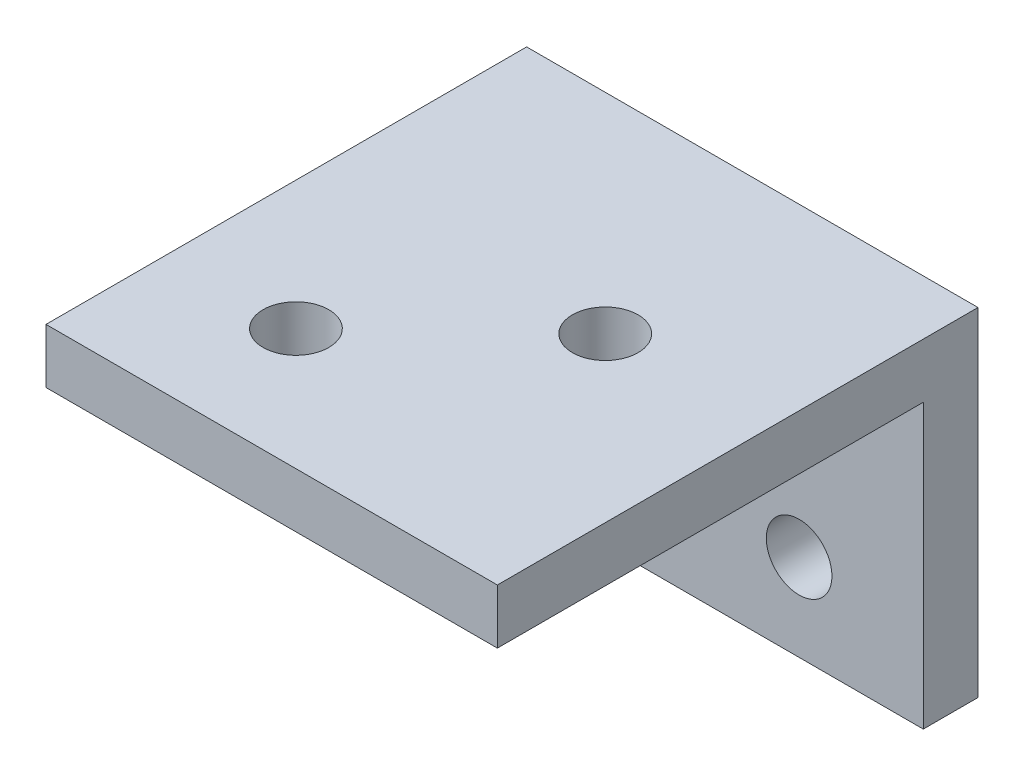
from build123d import *

# Parameters (mm, degrees)
SKETCH1_W           = 41.256811376
SKETCH1_H           = 15.875111739
SKETCH1_R           = 3
BOSS_EXTRUDE1_DEPTH = 5
SKETCH2_W           = 41.256811376
SKETCH2_H           = 15
BOSS_EXTRUDE3_DEPTH = 5
SKETCH3_W           = 41.256811376
SKETCH3_H           = 38.931242613
SKETCH3_R           = 3
BOSS_EXTRUDE5_DEPTH = 5


with BuildPart() as part:
    # Sketch1 → Boss-Extrude1 (new body)
    with BuildSketch(Plane.XY):
        with Locations((85.088811215, -27.526454456)):
            Rectangle(SKETCH1_W, SKETCH1_H)
        with Locations((94.366601686, -27.526454455)):
            Circle(SKETCH1_R, mode=Mode.SUBTRACT)
        with Locations((75.811020744, -27.526454455)):
            Circle(SKETCH1_R, mode=Mode.SUBTRACT)
    extrude(amount=BOSS_EXTRUDE1_DEPTH)

    # Sketch2 → Boss-Extrude3 (add)
    with BuildSketch(Plane.XY.offset(5)):
        with Locations((85.088811215, -42.964010325)):
            Rectangle(SKETCH2_W, SKETCH2_H)
    extrude(amount=-BOSS_EXTRUDE3_DEPTH)

    # Sketch3 → Boss-Extrude5 (add)
    with BuildSketch(Plane.XZ.offset(50.464010325)):
        with Locations((85.088811215, 24.465621307)):
            Rectangle(SKETCH3_W, SKETCH3_H)
        with Locations(Location((76.213848726, 32.840318874, 0), (0, 0, 270))):
            Circle(SKETCH3_R, mode=Mode.SUBTRACT)
        with Locations(Location((90.760010617, 19.114096734, 0), (0, 0, 270))):
            Circle(SKETCH3_R, mode=Mode.SUBTRACT)
    extrude(amount=-BOSS_EXTRUDE5_DEPTH)


with BuildPart() as body_2:
    # Mirror1: mirrored copy
    add(part.part.mirror(Plane(origin=(64.460405527, -19.588898586, 5), x_dir=(0, 0, 1), z_dir=(0, -1, 0))))


solid = body_2.part
